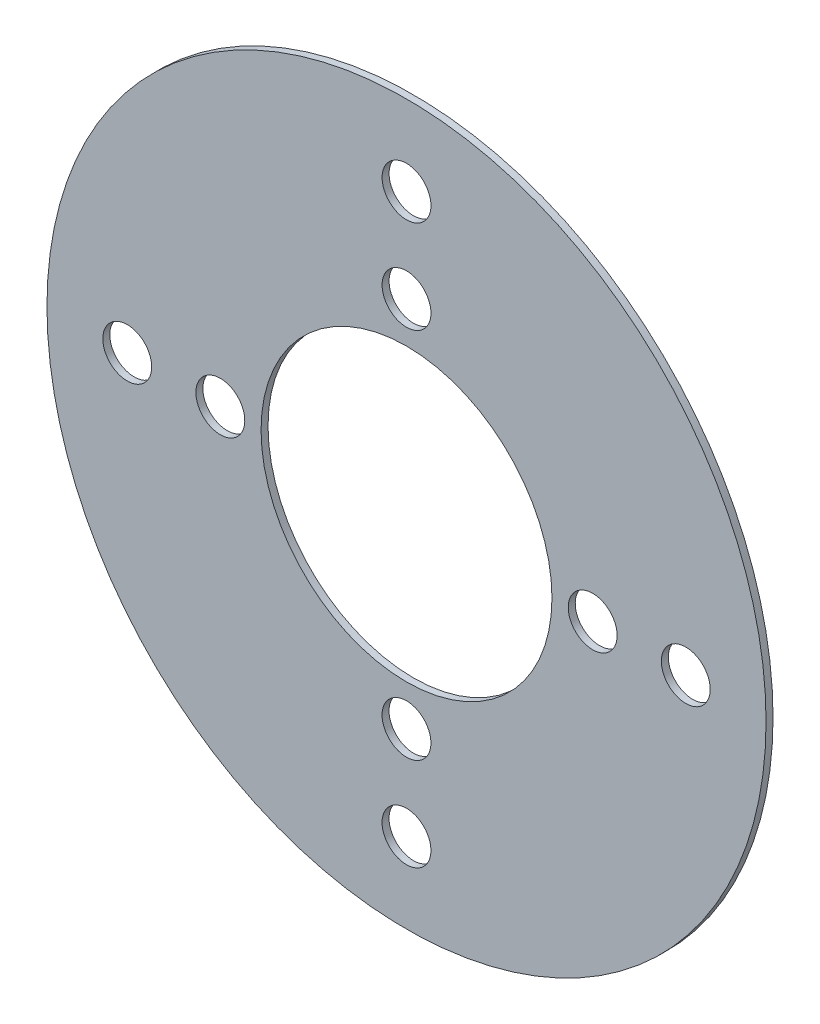
from build123d import *

# Parameters (mm, degrees)
ESQUISSE1_R                  = 30.9
ESQUISSE1_R_2                = 12.5
BOSS_EXTRU_1_DEPTH           = 0.6
ESQUISSE2_R                  = 2.1
ENL_V_MAT_EXTRU_1_DEPTH      = 44.703317952
R_P_TITION_CIRCULAIRE1_COUNT = 4


with BuildPart() as part:
    # Esquisse1 → Boss.-Extru.1 (new body)
    with BuildSketch(Plane.XY):
        Circle(ESQUISSE1_R)
        Circle(ESQUISSE1_R_2, mode=Mode.SUBTRACT)
    extrude(amount=BOSS_EXTRU_1_DEPTH)

    # Esquisse2 → Enlèv. mat.-Extru.1 (cut, through all)
    with BuildSketch(Plane.XY.offset(0.6)):
        with Locations((0, 16)):
            Circle(ESQUISSE2_R)
        with Locations((0, 24)):
            Circle(ESQUISSE2_R)
    enl_v_mat_extru_1 = extrude(amount=-ENL_V_MAT_EXTRU_1_DEPTH, mode=Mode.SUBTRACT)

    # Répétition circulaire1: Enlèv. mat.-Extru.1 ×4 about axis
    r_p_tition_circulaire1_axis = Axis((0, 0, 0), (0, 0, 1))
    for i in range(1, R_P_TITION_CIRCULAIRE1_COUNT):
        add(enl_v_mat_extru_1.rotate(r_p_tition_circulaire1_axis, i * 360 / R_P_TITION_CIRCULAIRE1_COUNT), mode=Mode.SUBTRACT)


solid = part.part
